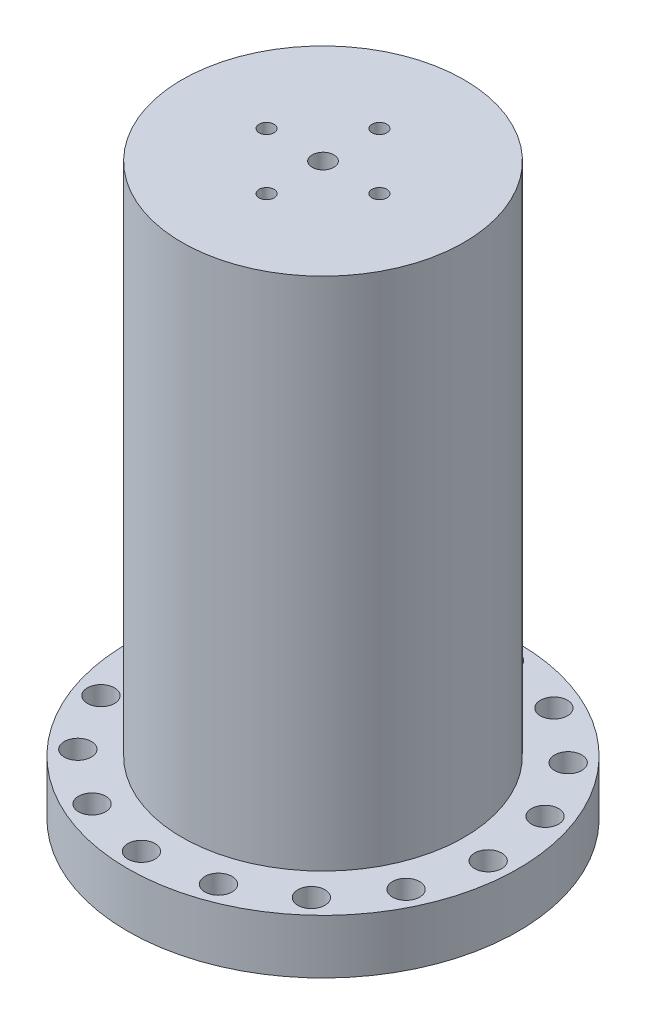
from build123d import *

# Parameters (mm, degrees)
SKETCH1_R           = 45.72
BOSS_EXTRUDE1_DEPTH = 12.7
SKETCH2_R           = 33.02
BOSS_EXTRUDE2_DEPTH = 120.65
SKETCH3_R           = 25.4
CUT_EXTRUDE1_DEPTH  = 128.27
SKETCH4_R           = 2.54
CUT_EXTRUDE2_DEPTH  = 128.27
SKETCH5_R           = 3.175
CUT_EXTRUDE3_DEPTH  = 128.27
SKETCH6_R           = 10.16
CUT_EXTRUDE4_DEPTH  = 0.127
CIRPATTERN1_COUNT   = 16
SKETCH7_R           = 1.7526
CUT_EXTRUDE5_DEPTH  = 144.644803944
CIRPATTERN2_COUNT   = 4


with BuildPart() as part:
    # Sketch1 → Boss-Extrude1 (new body)
    with BuildSketch(Plane(origin=(0, 0, 0), x_dir=(1, 0, 0), z_dir=(0, 1, 0))):
        Circle(SKETCH1_R)
    extrude(amount=BOSS_EXTRUDE1_DEPTH)

    # Sketch2 → Boss-Extrude2 (add)
    with BuildSketch(Plane(origin=(0, 12.7, 0), x_dir=(1, 0, 0), z_dir=(0, 1, 0))):
        Circle(SKETCH2_R)
    extrude(amount=BOSS_EXTRUDE2_DEPTH)

    # Sketch3 → Cut-Extrude1 (cut)
    with BuildSketch(Plane.XZ):
        Circle(SKETCH3_R)
    extrude(amount=-CUT_EXTRUDE1_DEPTH, mode=Mode.SUBTRACT)

    # Sketch4 → Cut-Extrude2 (cut)
    with BuildSketch(Plane(origin=(0, 133.35, 0), x_dir=(1, 0, 0), z_dir=(0, 1, 0))):
        Circle(SKETCH4_R)
    extrude(amount=-CUT_EXTRUDE2_DEPTH, mode=Mode.SUBTRACT)

    # Sketch5 → Cut-Extrude3 (cut)
    with BuildSketch(Plane.XZ):
        with Locations((-13.759658147, -38.23978828)):
            Circle(SKETCH5_R)
    cut_extrude3 = extrude(amount=-CUT_EXTRUDE3_DEPTH, mode=Mode.SUBTRACT)

    # Sketch6 → Cut-Extrude4 (cut)
    with BuildSketch(Plane.XZ.offset(-128.27)):
        Circle(SKETCH6_R)
    extrude(amount=-CUT_EXTRUDE4_DEPTH, mode=Mode.SUBTRACT)

    # CirPattern1: Cut-Extrude3 ×16 about axis
    cirpattern1_axis = Axis((0, 128.27, 0), (0, -1, 0))
    for i in range(1, CIRPATTERN1_COUNT):
        add(cut_extrude3.rotate(cirpattern1_axis, i * 360 / CIRPATTERN1_COUNT), mode=Mode.SUBTRACT)

    # Sketch7 → Cut-Extrude5 (cut, through all)
    with BuildSketch(Plane.XZ.offset(-128.27)):
        with Locations((13.208, 0)):
            Circle(SKETCH7_R)
    cut_extrude5 = extrude(amount=-CUT_EXTRUDE5_DEPTH, mode=Mode.SUBTRACT)

    # CirPattern2: Cut-Extrude5 ×4 about axis
    cirpattern2_axis = Axis((0, 128.27, 0), (0, -1, 0))
    for i in range(1, CIRPATTERN2_COUNT):
        add(cut_extrude5.rotate(cirpattern2_axis, i * 360 / CIRPATTERN2_COUNT), mode=Mode.SUBTRACT)


solid = part.part
